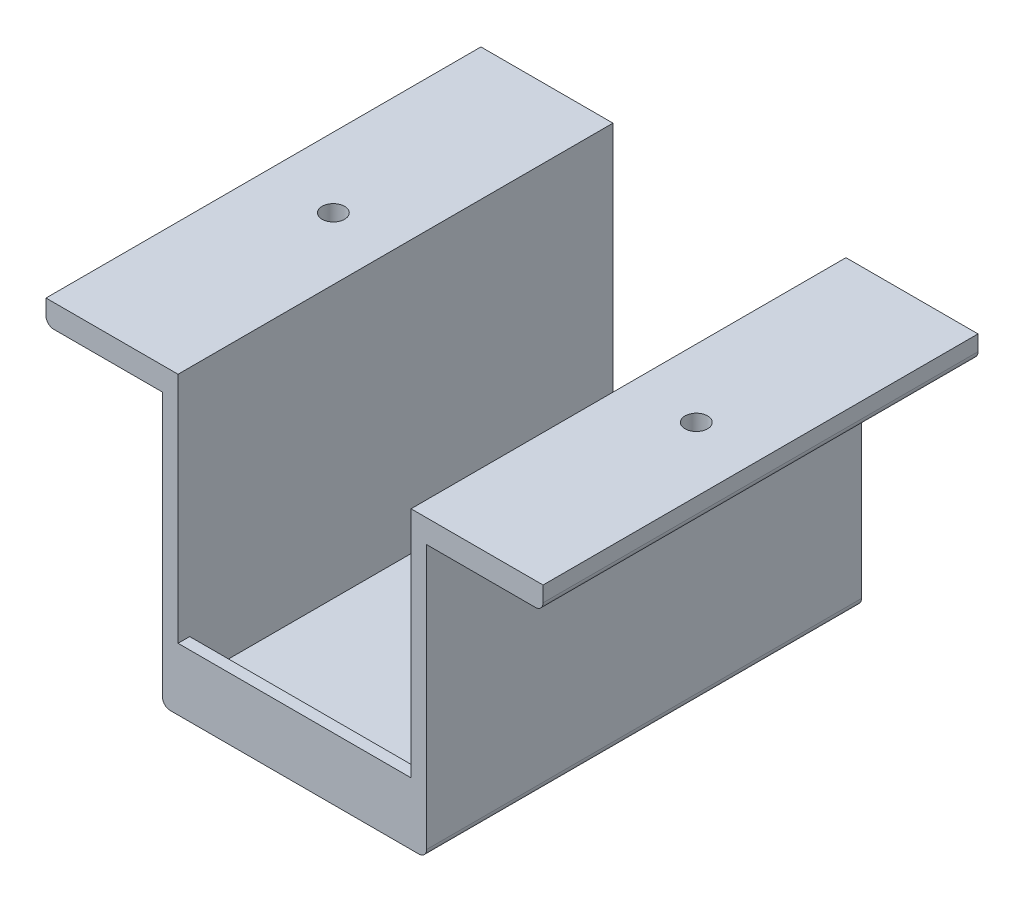
from build123d import *

# Parameters (mm, degrees)
SKETCH2_W           = 34
SKETCH2_H           = 56
BOSS_EXTRUDE1_DEPTH = 3
SKETCH3_W           = 2
SKETCH3_H           = 56
BOSS_EXTRUDE2_DEPTH = 35
SKETCH4_W           = 56
SKETCH4_H           = 2.991859995
BOSS_EXTRUDE3_DEPTH = 15
SKETCH5_W           = 56
SKETCH5_H           = 2.991859995
BOSS_EXTRUDE4_DEPTH = 15
SKETCH6_W           = 30
SKETCH6_H           = 2
SKETCH6_H_2         = 1.5
BOSS_EXTRUDE5_DEPTH = 5
SKETCH8_R           = 1.45
CUT_EXTRUDE1_DEPTH  = 75.275058866
FILLET1_R           = 1


with BuildPart() as part:
    # Sketch2 → Boss-Extrude1 (new body)
    with BuildSketch(Plane(origin=(0, 0, 0), x_dir=(1, 0, 0), z_dir=(0, 1, 0))):
        with Locations((17, 12.887459807)):
            Rectangle(SKETCH2_W, SKETCH2_H)
    extrude(amount=BOSS_EXTRUDE1_DEPTH)

    # Sketch3 → Boss-Extrude2 (add)
    with BuildSketch(Plane(origin=(0, 3, 0), x_dir=(1, 0, 0), z_dir=(0, 1, 0))):
        with Locations((1, 12.887459807)):
            Rectangle(SKETCH3_W, SKETCH3_H)
        with Locations((33, 12.887459807)):
            Rectangle(SKETCH3_W, SKETCH3_H)
    extrude(amount=BOSS_EXTRUDE2_DEPTH)

    # Sketch4 → Boss-Extrude3 (add)
    with BuildSketch(Plane(origin=(34, 0, 0), x_dir=(0, 0, -1), z_dir=(1, 0, 0))):
        with Locations((12.887459807, 36.504070003)):
            Rectangle(SKETCH4_W, SKETCH4_H)
    extrude(amount=BOSS_EXTRUDE3_DEPTH)

    # Sketch5 → Boss-Extrude4 (add)
    with BuildSketch(Plane.ZY):
        with Locations((-12.887459807, 36.504070003)):
            Rectangle(SKETCH5_W, SKETCH5_H)
    extrude(amount=BOSS_EXTRUDE4_DEPTH)

    # Sketch6 → Boss-Extrude5 (add)
    with BuildSketch(Plane(origin=(0, 3, 0), x_dir=(1, 0, 0), z_dir=(0, 1, 0))):
        with Locations((17, 39.887459807)):
            Rectangle(SKETCH6_W, SKETCH6_H)
        with Locations((17, -14.362540193)):
            Rectangle(SKETCH6_W, SKETCH6_H_2)
    extrude(amount=BOSS_EXTRUDE5_DEPTH)

    # Sketch8 → Cut-Extrude1 (cut, through all)
    with BuildSketch(Plane(origin=(0, 38, 0), x_dir=(1, 0, 0), z_dir=(0, 1, 0))):
        with Locations(Location((-6.002072166, 12.887459807, 0), (0, 0, 270))):
            Circle(SKETCH8_R)
        with Locations(Location((40.730432143, 12.887459807, 0), (0, 0, 270))):
            Circle(SKETCH8_R)
    extrude(amount=-CUT_EXTRUDE1_DEPTH, mode=Mode.SUBTRACT)

    # Fillet1
    fillet1_edges = [part.edges().sort_by_distance(p)[0] for p in [
        (49, 35.008140005, -12.887459807),
        (-15, 35.008140005, -12.887459807),
        (34, 0, -12.887459807),
        (0, 0, -12.887459807),
    ]]
    fillet(fillet1_edges, radius=FILLET1_R)


solid = part.part
